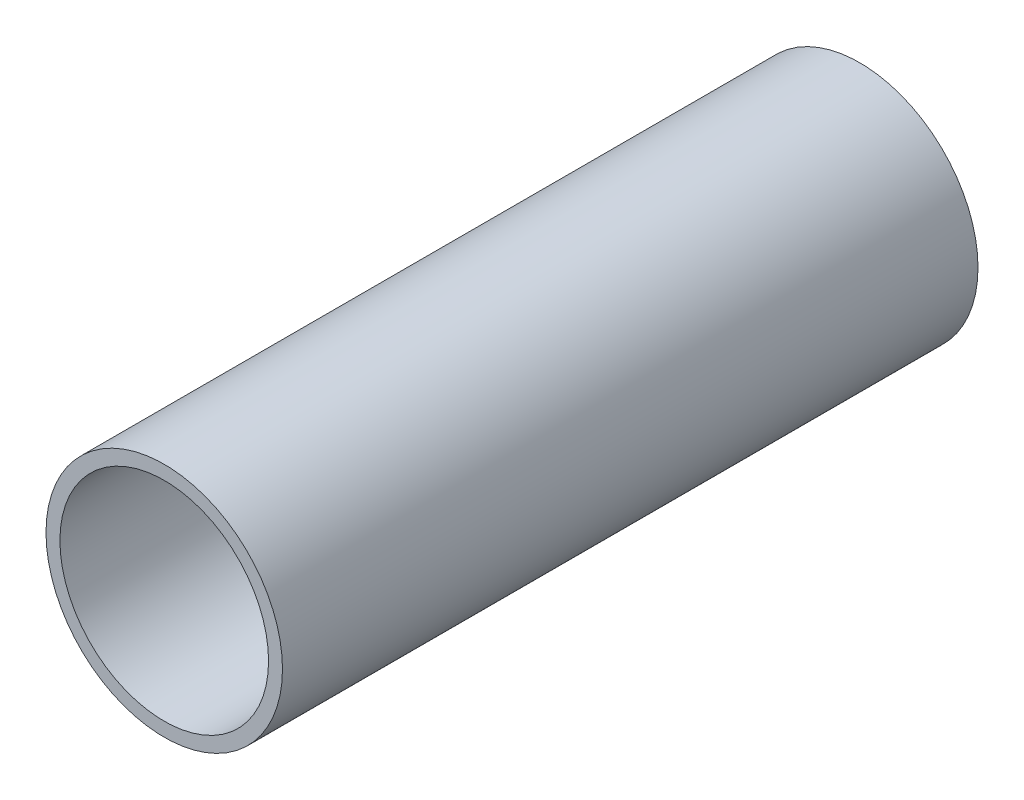
from build123d import *

# Parameters (mm, degrees)
SKETCH2_R           = 8.5
BOSS_EXTRUDE1_DEPTH = 50
CUT_EXTRUDE1_REACH  = 53.425
SKETCH3_R           = 7.5


with BuildPart() as part:
    # Sketch2 → Boss-Extrude1 (new body)
    with BuildSketch(Plane.XY):
        Circle(SKETCH2_R)
    extrude(amount=BOSS_EXTRUDE1_DEPTH)

    # Sketch3 → Cut-Extrude1 (cut, up to next)
    with BuildSketch(Plane.XY.offset(50), mode=Mode.PRIVATE) as cut_extrude1_sk1:
        Circle(SKETCH3_R)
    cut_extrude1_tool1 = extrude(cut_extrude1_sk1.sketch, amount=-CUT_EXTRUDE1_REACH, mode=Mode.PRIVATE) & part.part
    add(cut_extrude1_tool1.solids().sort_by_distance((0, 0, 50))[0], mode=Mode.SUBTRACT)


solid = part.part
